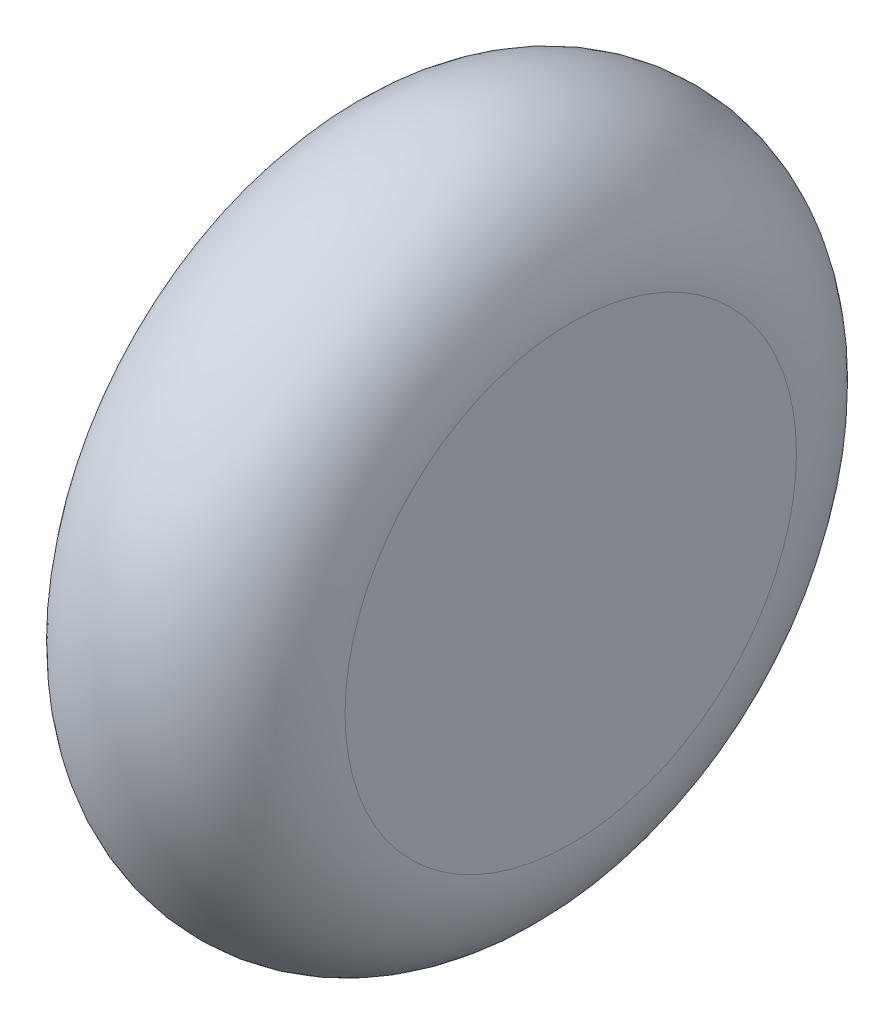
from build123d import *


with BuildPart() as part:
    # Sketch1 → Revolve1 (revolve)
    with BuildSketch(Plane(origin=(0, 0, 0), x_dir=(1, 0, 0), z_dir=(0, 1, 0)), mode=Mode.PRIVATE) as revolve1_sk:
        with BuildLine():
            Line((-25.4, 0), (-25.4, 46.355))
            ThreePointArc((-25.4, 46.355), (0, 71.755), (25.4, 46.355))
            Line((25.4, 46.355), (25.4, 0))
            Line((25.4, 0), (-25.4, 0))
        make_face()
    revolve(revolve1_sk.sketch.rotate(Axis((-123.825, 0, 0), (1, 0, 0)), 180), axis=Axis((-123.825, 0, 0), (1, 0, 0)))


solid = part.part
